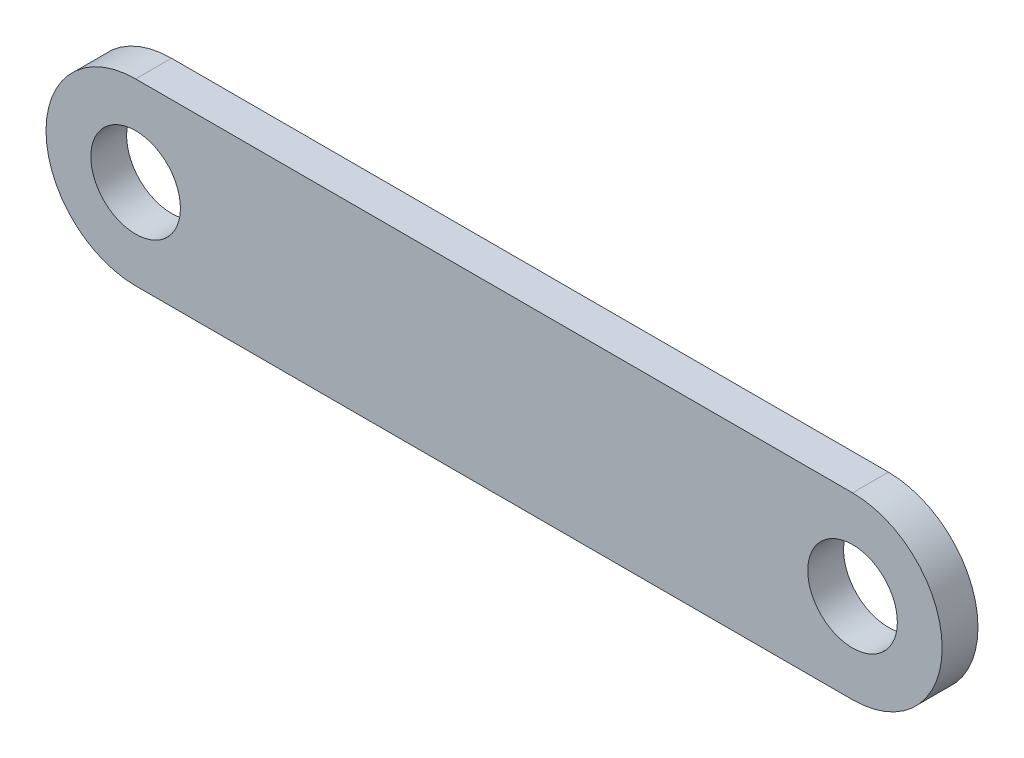
from build123d import *

# Parameters (mm, degrees)
SKETCH_1_R      = 5
EXTRUDE_1_DEPTH = 4


with BuildPart() as part:
    # ｽｹｯﾁ1 → ﾎﾞｽ - 押し出し1 (new body)
    with BuildSketch(Plane.XY):
        with BuildLine():
            Line((0, 10), (80, 10))
            ThreePointArc((80, 10), (90, 0), (80, -10))
            Line((80, -10), (0, -10))
            ThreePointArc((0, -10), (-10, 0), (0, 10))
        make_face()
        Circle(SKETCH_1_R, mode=Mode.SUBTRACT)
        with Locations((80, 0)):
            Circle(SKETCH_1_R, mode=Mode.SUBTRACT)
    extrude(amount=EXTRUDE_1_DEPTH)


solid = part.part
